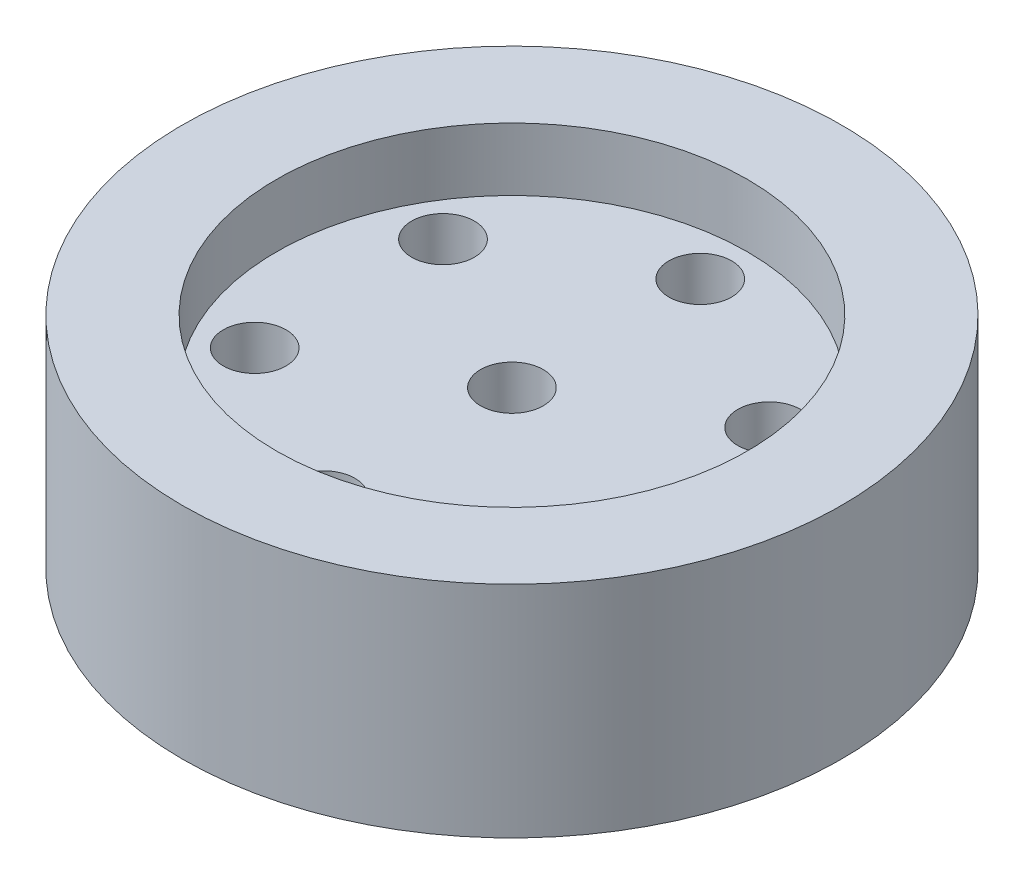
from build123d import *

# Parameters (mm, degrees)
SKETCH1_R           = 21
BOSS_EXTRUDE1_DEPTH = 14
SKETCH2_R           = 15
CUT_EXTRUDE1_DEPTH  = 4
SKETCH3_R           = 19
SKETCH3_R_2         = 5
CUT_EXTRUDE2_DEPTH  = 4
SKETCH4_R           = 2
CUT_EXTRUDE3_DEPTH  = 33.832910319
SKETCH5_R           = 2
CUT_EXTRUDE4_DEPTH  = 32.336879232


with BuildPart() as part:
    # Sketch1 → Boss-Extrude1 (new body)
    with BuildSketch(Plane(origin=(0, 0, 0), x_dir=(1, 0, 0), z_dir=(0, 1, 0))):
        with Locations(Location((0, 0, 0), (0, 0, 270))):
            Circle(SKETCH1_R)
    extrude(amount=BOSS_EXTRUDE1_DEPTH)

    # Sketch2 → Cut-Extrude1 (cut)
    with BuildSketch(Plane(origin=(0, 14, 0), x_dir=(1, 0, 0), z_dir=(0, 1, 0))):
        with Locations(Location((0, 0, 0), (0, 0, 270))):
            Circle(SKETCH2_R)
    extrude(amount=-CUT_EXTRUDE1_DEPTH, mode=Mode.SUBTRACT)

    # Sketch3 → Cut-Extrude2 (cut)
    with BuildSketch(Plane.XZ):
        with Locations(Location((0, 0, 0), (0, 0, 270))):
            Circle(SKETCH3_R)
        with Locations(Location((0, 0, 0), (0, 0, 270))):
            Circle(SKETCH3_R_2, mode=Mode.SUBTRACT)
    extrude(amount=-CUT_EXTRUDE2_DEPTH, mode=Mode.SUBTRACT)

    # Sketch4 → Cut-Extrude3 (cut, through all)
    with BuildSketch(Plane.XZ):
        with Locations(Location((0, 0, 0), (0, 0, 270))):
            Circle(SKETCH4_R)
    extrude(amount=-CUT_EXTRUDE3_DEPTH, mode=Mode.SUBTRACT)

    # Sketch5 → Cut-Extrude4 (cut, through all)
    with BuildSketch(Plane.XZ.offset(-4)):
        with Locations(Location((0, 12, 0), (0, 0, 270))):
            Circle(SKETCH5_R)
        with Locations(Location((10.392304845, 6, 0), (0, 0, 270))):
            Circle(SKETCH5_R)
        with Locations(Location((10.392304845, -6, 0), (0, 0, 270))):
            Circle(SKETCH5_R)
        with Locations(Location((0, -12, 0), (0, 0, 270))):
            Circle(SKETCH5_R)
        with Locations(Location((-10.392304845, -6, 0), (0, 0, 270))):
            Circle(SKETCH5_R)
        with Locations(Location((-10.392304845, 6, 0), (0, 0, 270))):
            Circle(SKETCH5_R)
    extrude(amount=-CUT_EXTRUDE4_DEPTH, mode=Mode.SUBTRACT)


solid = part.part
